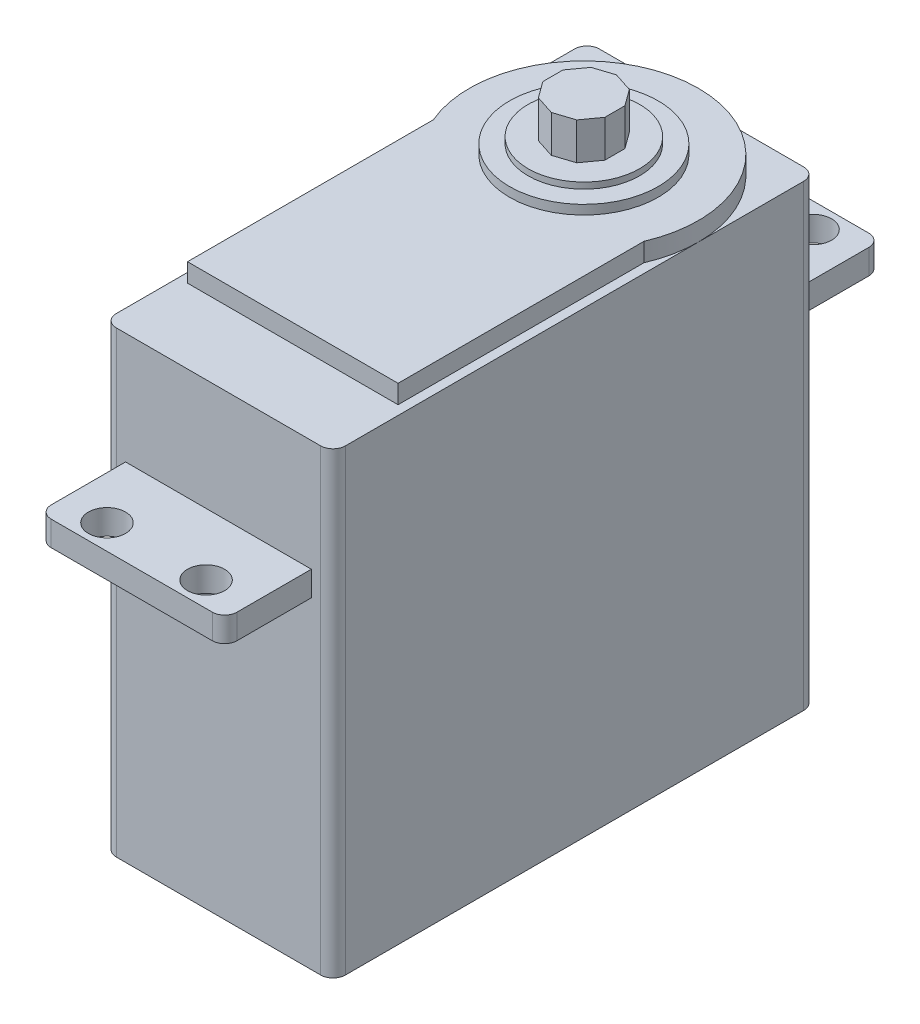
from build123d import *

# Parameters (mm, degrees)
BOSS_EXTRUDE1_DEPTH = 37
BOSS_EXTRUDE2_DEPTH = 1.5
SKETCH4_R           = 6
BOSS_EXTRUDE3_DEPTH = 0.75
SKETCH5_R           = 4.5
BOSS_EXTRUDE4_DEPTH = 0.5
BOSS_EXTRUDE5_DEPTH = 3
SKETCH8_R           = 1.5
BOSS_EXTRUDE6_DEPTH = 2


with BuildPart() as part:
    # Sketch1 → Boss-Extrude1 (new body)
    with BuildSketch(Plane(origin=(0, 0, 0), x_dir=(1, 0, 0), z_dir=(0, 1, 0))):
        with BuildLine():
            Line((-8.25, 19.5), (8.25, 19.5))
            ThreePointArc((8.25, 19.5), (8.957106781, 19.207106781), (9.25, 18.5))
            Line((9.25, 18.5), (9.25, -18.5))
            ThreePointArc((9.25, -18.5), (8.957106781, -19.207106781), (8.25, -19.5))
            Line((8.25, -19.5), (-8.25, -19.5))
            ThreePointArc((-8.25, -19.5), (-8.957106781, -19.207106781), (-9.25, -18.5))
            Line((-9.25, -18.5), (-9.25, 18.5))
            ThreePointArc((-9.25, 18.5), (-8.957106781, 19.207106781), (-8.25, 19.5))
        make_face()
    extrude(amount=BOSS_EXTRUDE1_DEPTH)

    # Sketch3 → Boss-Extrude2 (add)
    with BuildSketch(Plane(origin=(0, 37, 0), x_dir=(1, 0, 0), z_dir=(0, 1, 0))):
        with BuildLine():
            Line((8.5, -13.5), (-8.5, -13.5))
            Line((-8.5, -13.5), (-8.5, 6.35137012))
            ThreePointArc((-8.5, 6.35137012), (0, 19.25), (8.5, 6.35137012))
            Line((8.5, 6.35137012), (8.5, -13.5))
        make_face()
    extrude(amount=BOSS_EXTRUDE2_DEPTH)

    # Sketch4 → Boss-Extrude3 (add)
    with BuildSketch(Plane(origin=(0, 38.5, 0), x_dir=(1, 0, 0), z_dir=(0, 1, 0))):
        with Locations(Location((0, 10, 0), (0, 0, 270))):
            Circle(SKETCH4_R)
    extrude(amount=BOSS_EXTRUDE3_DEPTH)

    # Sketch5 → Boss-Extrude4 (add)
    with BuildSketch(Plane(origin=(0, 39.25, 0), x_dir=(1, 0, 0), z_dir=(0, 1, 0))):
        with Locations(Location((0, 10, 0), (0, 0, 270))):
            Circle(SKETCH5_R)
    extrude(amount=BOSS_EXTRUDE4_DEPTH)

    # Sketch6 → Boss-Extrude5 (add)
    with BuildSketch(Plane(origin=(0, 39.75, 0), x_dir=(1, 0, 0), z_dir=(0, 1, 0))):
        Polygon((-2.5, 9.187700759), (-1.545084972, 7.873372979), (0, 7.371344439), (1.545084972, 7.873372979), (2.5, 9.187700759), (2.5, 10.812299241), (1.545084972, 12.126627021), (0, 12.628655561), (-1.545084972, 12.126627021), (-2.5, 10.812299241), align=None)
    extrude(amount=BOSS_EXTRUDE5_DEPTH)

    # Sketch8 → Boss-Extrude6 (add)
    # profile 1 of 2: a face of its own
    with BuildSketch(Plane(origin=(0, 26, 0), x_dir=(-1, 0, 0), z_dir=(0, -1, 0))):
        with BuildLine():
            ThreePointArc((-7.5, 25.5), (-7.207106781, 26.207106781), (-6.5, 26.5))
            Line((-6.5, 26.5), (6.5, 26.5))
            ThreePointArc((6.5, 26.5), (7.207106781, 26.207106781), (7.5, 25.5))
            Line((7.5, 25.5), (7.5, 19.5))
            Line((7.5, 19.5), (-7.5, 19.5))
            Line((-7.5, 19.5), (-7.5, 25.5))
        make_face()
        with Locations(Location((4, 24.5, 0), (0, 0, 90))):
            Circle(SKETCH8_R, mode=Mode.SUBTRACT)
        with Locations(Location((-4, 24.5, 0), (0, 0, 90))):
            Circle(SKETCH8_R, mode=Mode.SUBTRACT)
    # profile 2 of 2: a face of its own
    with BuildSketch(Plane(origin=(0, 26, 0), x_dir=(-1, 0, 0), z_dir=(0, -1, 0))):
        with BuildLine():
            Line((-7.5, -19.5), (-7.5, -25.5))
            ThreePointArc((-7.5, -25.5), (-7.207106781, -26.207106781), (-6.5, -26.5))
            Line((-6.5, -26.5), (6.5, -26.5))
            ThreePointArc((6.5, -26.5), (7.207106781, -26.207106781), (7.5, -25.5))
            Line((7.5, -25.5), (7.5, -19.5))
            Line((7.5, -19.5), (-7.5, -19.5))
        make_face()
        with Locations(Location((-4, -24.5, 0), (0, 0, 90))):
            Circle(SKETCH8_R, mode=Mode.SUBTRACT)
        with Locations(Location((4, -24.5, 0), (0, 0, 90))):
            Circle(SKETCH8_R, mode=Mode.SUBTRACT)
    extrude(amount=-BOSS_EXTRUDE6_DEPTH)


solid = part.part
